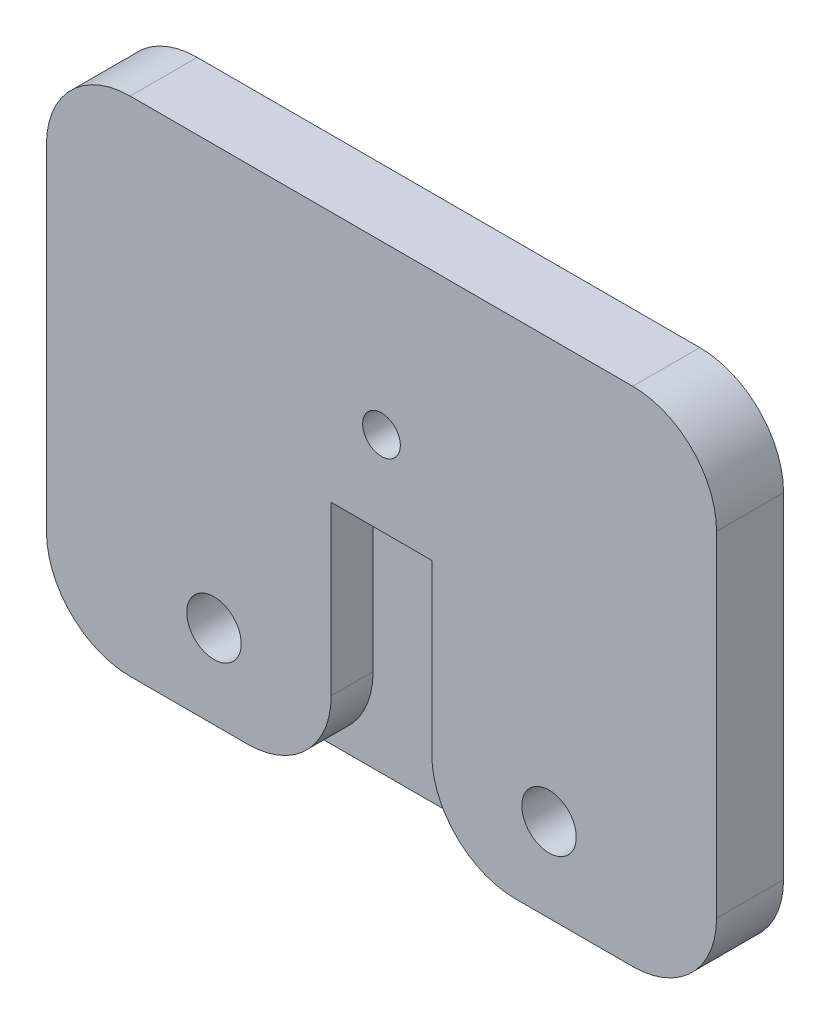
from build123d import *

# Parameters (mm, degrees)
SKETCH_1_R          = 3.25
SKETCH_1_R_2        = 2.25
EXTRUDE_1_DEPTH     = 8
SKETCH_1_3_R        = 5
SKETCH_1_3_R_2      = 2.25
CUT_EXTRUDE_1_DEPTH = 3.3
SKETCH_2_W          = 12
SKETCH_2_H          = 30
CUT_EXTRUDE_2_DEPTH = 5
FILLET_1_R          = 10


with BuildPart() as part:
    # 草图1 → 凸台-拉伸1 (new body)
    with BuildSketch(Plane.XY):
        with BuildLine():
            ThreePointArc((40, 20), (37.071067812, 27.071067812), (30, 30))
            Line((30, 30), (-30, 30))
            ThreePointArc((-30, 30), (-37.071067812, 27.071067812), (-40, 20))
            Line((-40, 20), (-40, -20))
            ThreePointArc((-40, -20), (-37.071067812, -27.071067812), (-30, -30))
            Line((-30, -30), (30, -30))
            ThreePointArc((30, -30), (37.071067812, -27.071067812), (40, -20))
            Line((40, -20), (40, 20))
        make_face()
        with Locations((-20, -20)):
            Circle(SKETCH_1_R, mode=Mode.SUBTRACT)
        with Locations((20, -20)):
            Circle(SKETCH_1_R, mode=Mode.SUBTRACT)
        with Locations((0, 10)):
            Circle(SKETCH_1_R_2, mode=Mode.SUBTRACT)
    extrude(amount=EXTRUDE_1_DEPTH)

    # 草图1<3> → 切除-拉伸1 (cut)
    with BuildSketch(Plane.XY):
        with Locations((0, 10)):
            Circle(SKETCH_1_3_R)
        with Locations((0, 10)):
            Circle(SKETCH_1_3_R_2, mode=Mode.SUBTRACT)
    extrude(amount=CUT_EXTRUDE_1_DEPTH, mode=Mode.SUBTRACT)

    # 草图2 → 切除-拉伸2 (cut)
    with BuildSketch(Plane.XY.offset(8)):
        with Locations((0, -15)):
            Rectangle(SKETCH_2_W, SKETCH_2_H)
    extrude(amount=-CUT_EXTRUDE_2_DEPTH, mode=Mode.SUBTRACT)

    # 圆角1
    fillet_1_edges = [part.edges().sort_by_distance(p)[0] for p in [
        (-6, -30, 5.5),
        (6, -30, 5.5),
    ]]
    fillet(fillet_1_edges, radius=FILLET_1_R)


solid = part.part
